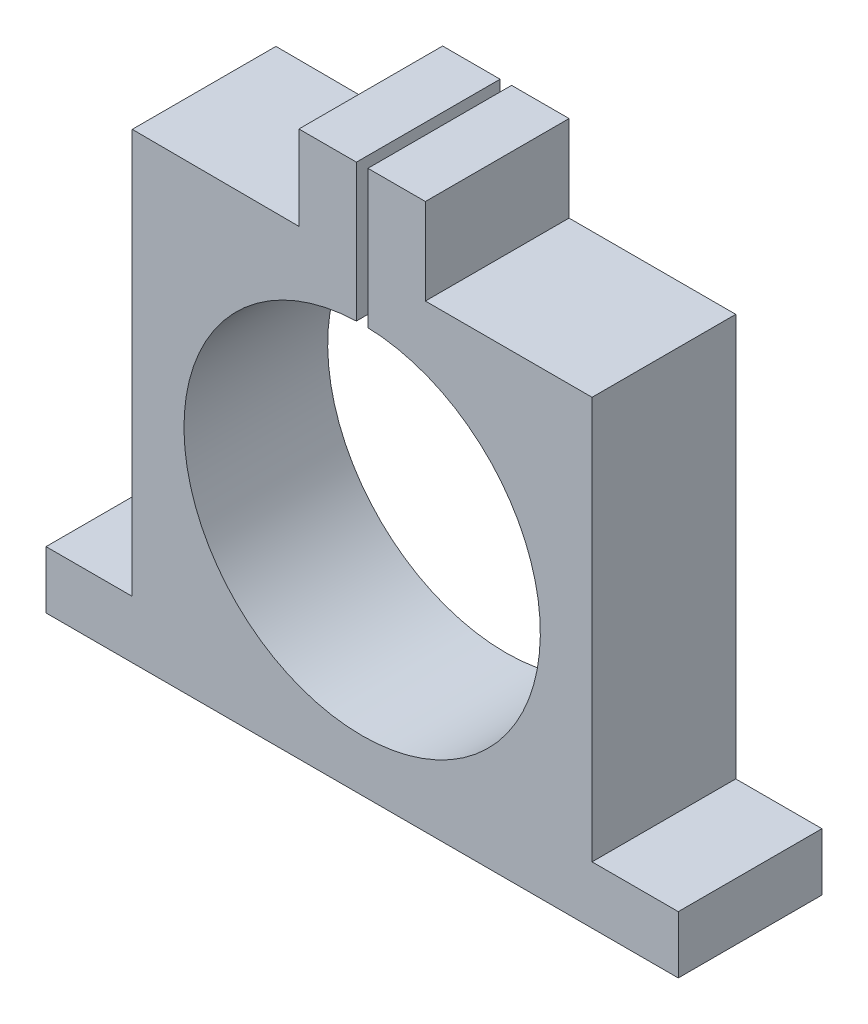
from build123d import *

# Parameters (mm, degrees)
SALIENTE_EXTRUIR5_DEPTH = 25


with BuildPart() as part:
    # Croquis1 → Saliente-Extruir5 (new body)
    with BuildSketch(Plane.XY):
        with BuildLine():
            Line((-103.421749263, -28.548605363), (-103.421749263, -38.548605363))
            Line((-103.421749263, -38.548605363), (6.578250737, -38.548605363))
            Line((6.578250737, -38.548605363), (6.578250737, -28.548605363))
            Line((6.578250737, -28.548605363), (-8.421749263, -28.548605363))
            Line((-8.421749263, -28.548605363), (-8.421749263, 41.451394637))
            Line((-8.421749263, 41.451394637), (-37.421749263, 41.451394637))
            Line((-37.421749263, 41.451394637), (-37.421749263, 56.451394637))
            Line((-37.421749263, 56.451394637), (-47.421749263, 56.451394637))
            Line((-47.421749263, 56.451394637), (-47.421749263, 32.435261406))
            ThreePointArc((-47.421749263, 32.435261406), (-26.150691812, 23.015253289), (-17.421749263, 1.451394637))
            ThreePointArc((-17.421749263, 1.451394637), (-69.985607916, -20.819662815), (-49.421749263, 32.435261406))
            Line((-49.421749263, 32.435261406), (-49.421749263, 56.380232155))
            Line((-49.421749263, 56.380232155), (-59.421749263, 56.380232155))
            Line((-59.421749263, 56.380232155), (-59.421749263, 41.704732865))
            Line((-59.421749263, 41.704732865), (-88.421749263, 41.824609442))
            Line((-88.421749263, 41.824609442), (-88.421749263, -28.548605363))
            Line((-88.421749263, -28.548605363), (-103.421749263, -28.548605363))
        make_face()
    extrude(amount=SALIENTE_EXTRUIR5_DEPTH)


solid = part.part
